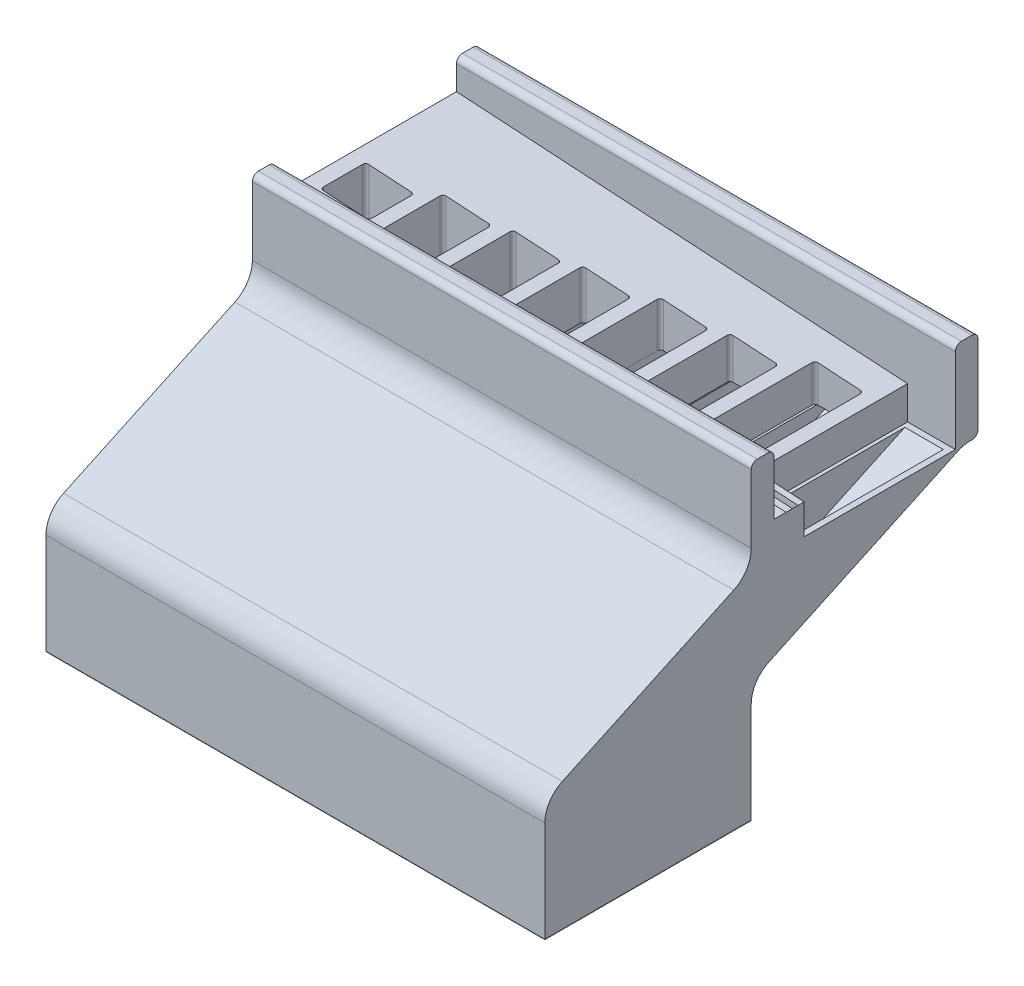
from build123d import *

# Parameters (mm, degrees)
BOSS_EXTRUDE1_DEPTH = 38.1
SKETCH2_W           = 209.55
SKETCH2_H           = 38.1
BOSS_EXTRUDE2_DEPTH = 9.525
SKETCH3_W           = 20.32
SKETCH3_H           = 19.05
SKETCH3_H_2         = 25.4
SKETCH3_H_3         = 28.575
SKETCH3_H_4         = 31.75
SKETCH3_H_5         = 38.1
SKETCH3_H_6         = 41.275
SKETCH3_H_7         = 50.8
SKETCH3_H_8         = 63.5
CUT_EXTRUDE1_DEPTH  = 123.141181515
SKETCH6_W           = 209.934495736
SKETCH6_H           = 5.08
CUT_EXTRUDE2_DEPTH  = 2.54
FILLET1_R           = 2.54
FILLET2_R           = 1.27
BOSS_EXTRUDE3_DEPTH = 209.55
SHELL1_T            = -2.54
BOSS_EXTRUDE4_DEPTH = 1.27
LPATTERN1_COUNT     = 7
LPATTERN1_PITCH     = 26.67
FILLET6_R           = 12.7
FILLET7_R           = 0.508
FILLET8_R           = 12.7
FILLET9_R           = 12.7
FILLET10_R          = 12.7
FILLET11_R          = 12.7


with BuildPart() as part:
    # Sketch1 → Boss-Extrude1 (new, symmetric)
    with BuildSketch(Plane.XY):
        Polygon((-105.823993484, 0), (103.726006516, 0), (103.726006516, 12.7), (-105.823993484, 25.4), align=None)
    extrude(amount=BOSS_EXTRUDE1_DEPTH, both=True)

    # Sketch2 → Boss-Extrude2 (add)
    with BuildSketch(Plane(origin=(0, 0, -38.1), x_dir=(-1, 0, 0), z_dir=(0, 0, -1))):
        with Locations((1.048993484, 19.05)):
            Rectangle(SKETCH2_W, SKETCH2_H)
    boss_extrude2 = extrude(amount=BOSS_EXTRUDE2_DEPTH)

    # Mirror1: Boss-Extrude2 across plane
    add(boss_extrude2.mirror(Plane.XY))

    # Sketch3 → Cut-Extrude1 (cut, through all)
    with BuildSketch(Plane.XZ):
        with Locations((-89.313993484, 15.875)):
            Rectangle(SKETCH3_W, SKETCH3_H)
        with Locations((-63.151993484, 12.7)):
            Rectangle(SKETCH3_W, SKETCH3_H_2)
        with Locations((-36.989993484, 11.1125)):
            Rectangle(SKETCH3_W, SKETCH3_H_3)
        with Locations((-10.827993484, 9.525)):
            Rectangle(SKETCH3_W, SKETCH3_H_4)
        with Locations((15.334006516, 6.35)):
            Rectangle(SKETCH3_W, SKETCH3_H_5)
        with Locations((41.496006516, 4.7625)):
            Rectangle(SKETCH3_W, SKETCH3_H_6)
        with Locations((67.658006516, 0)):
            Rectangle(SKETCH3_W, SKETCH3_H_7)
        with Locations((93.820006516, -6.35)):
            Rectangle(SKETCH3_W, SKETCH3_H_8)
    extrude(amount=-CUT_EXTRUDE1_DEPTH, mode=Mode.SUBTRACT)

    # Sketch6 → Cut-Extrude2 (cut)
    with BuildSketch(Plane(origin=(1.146481268, 18.916940924, 0), x_dir=(0.9981684966311909, -0.06049506040189038, 0), z_dir=(0.06049506040189037, 0.9981684966311908, 0))):
        with Locations((-2.19950315, -30.48)):
            Rectangle(SKETCH6_W, SKETCH6_H)
    extrude(amount=-CUT_EXTRUDE2_DEPTH, mode=Mode.SUBTRACT)

    # Fillet1
    fillet1_edges = [part.edges().sort_by_distance(p)[0] for p in [
        (-1.048993484, 38.1, -38.1),
        (-1.048993484, 0, -47.625),
        (-1.048993484, 38.1, -47.625),
        (-1.048993484, 38.1, 38.1),
        (-1.048993484, 38.1, 47.625),
        (-1.048993484, 0, 47.625),
    ]]
    fillet(fillet1_edges, radius=FILLET1_R)

    # Fillet2
    fillet2_edges = [part.edges().sort_by_distance(p)[0] for p in [
        (-20.987993484, 10.129212121, -6.35),
        (-20.987993484, 10.129212121, 25.4),
        (-0.667993484, 9.513454545, 25.4),
        (-0.667993484, 9.513454545, -6.35),
        (5.174006516, 9.336424242, -12.7),
        (5.174006516, 9.336424242, 25.4),
        (25.494006516, 8.720666667, 25.4),
        (25.494006516, 8.720666667, -12.7),
        (31.336006516, 8.543636364, -15.875),
        (31.336006516, 8.543636364, 25.4),
        (51.656006516, 7.927878788, 25.4),
        (51.656006516, 7.927878788, -15.875),
        (57.498006516, 7.750848485, -25.4),
        (57.498006516, 7.750848485, 25.4),
        (77.818006516, 7.135090909, 25.4),
        (77.818006516, 7.135090909, -25.4),
        (83.660006516, 6.958060606, 25.4),
        (-99.473993484, 12.507575758, 25.4),
        (-79.153993484, 11.891818182, 25.4),
        (-79.153993484, 11.891818182, 6.35),
        (-99.473993484, 12.507575758, 6.35),
        (-73.311993484, 11.714787879, 0),
        (-73.311993484, 11.714787879, 25.4),
        (-52.991993484, 11.099030303, 25.4),
        (-52.991993484, 11.099030303, 0),
        (-47.149993484, 10.922, -3.175),
        (-47.149993484, 10.922, 25.4),
        (-26.829993484, 10.306242424, 25.4),
        (-26.829993484, 10.306242424, -3.175),
    ]]
    fillet(fillet2_edges, radius=FILLET2_R)



with BuildPart() as body_2:
    # Sketch8 → Boss-Extrude3 (new body)
    with BuildSketch(Plane(origin=(103.726006516, 0, 0), x_dir=(0, 0, -1), z_dir=(1, 0, 0))):
        Polygon((-45.085, 0), (-134.3025, -41.602803491), (-134.3025, -92.402803491), (-47.625, -92.402803491), (-47.625, -41.602803491), (41.5925, 0), align=None)
    extrude(amount=-BOSS_EXTRUDE3_DEPTH)

    # Shell1
    shell1_openings = [body_2.faces().sort_by_distance(p)[0] for p in [
        (-1.048993484, -92.402803491, 90.96375),
        (-1.048993484, 0, 1.74625),
    ]]
    offset(amount=SHELL1_T, openings=shell1_openings, kind=Kind.INTERSECTION)


with BuildPart() as part_1:
    add(part.part)

    add(body_2.part)  # Boss-Extrude4 merges body 2
    # Sketch11 → Boss-Extrude4 (add, symmetric)
    with BuildSketch(Plane.ZY.offset(76.232993484)):
        Polygon((45.085, 0), (-41.5925, 0), (47.625, -41.602803491), (47.625, -92.402803491), (134.3025, -92.402803491), (134.3025, -41.602803491), align=None)
    boss_extrude4 = extrude(amount=BOSS_EXTRUDE4_DEPTH, both=True)

    # LPattern1: Boss-Extrude4 ×7
    with Locations(*[(i * LPATTERN1_PITCH, 0, 0) for i in range(1, LPATTERN1_COUNT)]):
        add(boss_extrude4)

    # Fillet6
    fillet6_edges = [part_1.edges().sort_by_distance(p)[0] for p in [
        (-1.048993484, -41.602803491, 134.3025),
        (-1.048993484, -41.602803491, 47.625),
    ]]
    fillet(fillet6_edges, radius=FILLET6_R)

    # Fillet7
    fillet7_edges = [part_1.edges().sort_by_distance(p)[0] for p in [
        (-1.048993484, -92.402803491, 47.625),
        (-1.048993484, -92.402803491, 134.3025),
        (-74.962993484, -92.402803491, 90.96375),
        (-77.502993484, -92.402803491, 90.96375),
        (-103.283993484, -92.402803491, 90.96375),
        (-90.393493484, -92.402803491, 131.7625),
        (-90.393493484, -92.402803491, 50.165),
        (-62.897993484, -92.402803491, 131.7625),
        (101.186006516, -92.402803491, 90.96375),
        (103.726006516, -92.402803491, 90.96375),
        (-105.823993484, -92.402803491, 90.96375),
        (-62.897993484, -92.402803491, 50.165),
        (-36.227993484, -92.402803491, 131.7625),
        (-9.557993484, -92.402803491, 131.7625),
        (17.112006516, -92.402803491, 131.7625),
        (43.782006516, -92.402803491, 131.7625),
        (70.452006516, -92.402803491, 131.7625),
        (93.121506516, -92.402803491, 131.7625),
        (-36.227993484, -92.402803491, 50.165),
        (-9.557993484, -92.402803491, 50.165),
        (17.112006516, -92.402803491, 50.165),
        (43.782006516, -92.402803491, 50.165),
        (70.452006516, -92.402803491, 50.165),
        (93.121506516, -92.402803491, 50.165),
        (-48.292993484, -92.402803491, 90.96375),
        (-50.832993484, -92.402803491, 90.96375),
        (-21.622993484, -92.402803491, 90.96375),
        (-24.162993484, -92.402803491, 90.96375),
        (5.047006516, -92.402803491, 90.96375),
        (2.507006516, -92.402803491, 90.96375),
        (31.717006516, -92.402803491, 90.96375),
        (29.177006516, -92.402803491, 90.96375),
        (58.387006516, -92.402803491, 90.96375),
        (55.847006516, -92.402803491, 90.96375),
        (85.057006516, -92.402803491, 90.96375),
        (82.517006516, -92.402803491, 90.96375),
    ]]
    fillet(fillet7_edges, radius=FILLET7_R)

    # Fillet8
    fillet8_edges = [part_1.edges().sort_by_distance(p)[0] for p in [
        (-90.393493484, -43.220961954, 131.7625),
        (-62.897993484, -43.220961954, 131.7625),
        (-36.227993484, -43.220961954, 131.7625),
        (-9.557993484, -43.220961954, 131.7625),
        (17.112006516, -43.220961954, 131.7625),
        (43.782006516, -43.220961954, 131.7625),
        (70.452006516, -43.220961954, 131.7625),
        (93.121506516, -43.220961954, 131.7625),
    ]]
    fillet(fillet8_edges, radius=FILLET8_R)

    # Fillet9
    fillet9_edges = [part_1.edges().sort_by_distance(p)[0] for p in [
        (-62.897993484, -39.984645029, 50.165),
        (-36.227993484, -39.984645029, 50.165),
        (-9.557993484, -39.984645029, 50.165),
        (17.112006516, -39.984645029, 50.165),
        (43.782006516, -39.984645029, 50.165),
        (70.452006516, -39.984645029, 50.165),
        (93.121506516, -39.984645029, 50.165),
    ]]
    fillet(fillet9_edges, radius=FILLET9_R)

    # Fillet10
    fillet10_edges = [part_1.edges().sort_by_distance(p)[0] for p in [
        (-1.048993484, 0, 45.085),
    ]]
    fillet(fillet10_edges, radius=FILLET10_R)

    # Fillet11
    fillet11_edges = [part_1.edges().sort_by_distance(p)[0] for p in [
        (-1.048993484, 0, -41.5925),
    ]]
    fillet(fillet11_edges, radius=FILLET11_R)


solid = part_1.part
